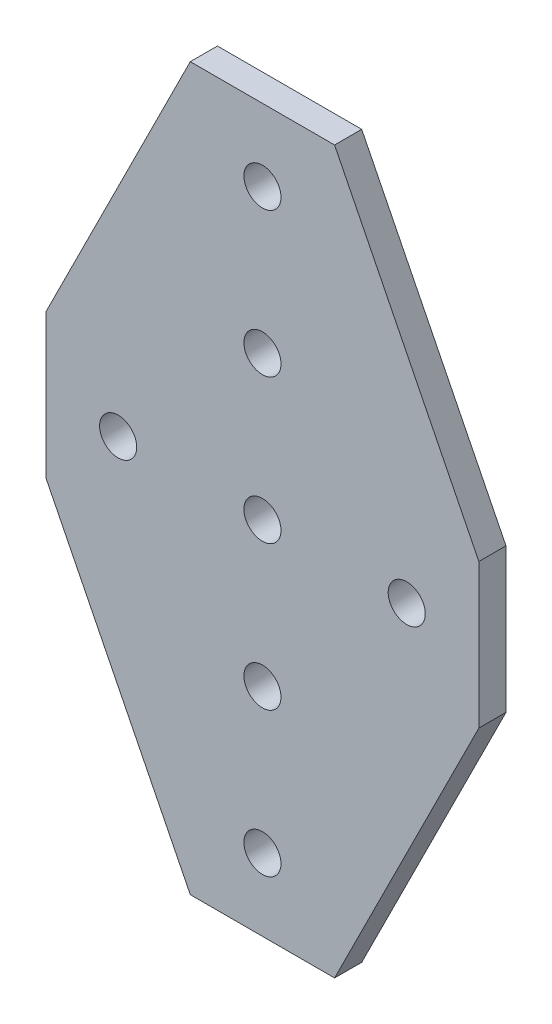
from build123d import *

# Parameters (mm, degrees)
BOSS_EXTRUDE1_DEPTH      = 2.3876
BOSS_EXTRUDE1_DEPTH_BACK = 2.3876
CUT_EXTRUDE1_DEPTH       = 75.206890078
CUT_EXTRUDE1_DEPTH_BACK  = 75.206890078
SKETCH4_R                = 3.2639
SKETCH5_R                = 3.2639
CUT_EXTRUDE2_DEPTH       = 75.206890078


with BuildPart() as part:
    # Sketch3 → Boss-Extrude1 (new, two sides: drawn at the far end of the back side and taken through both)
    with BuildSketch(Plane.XY.offset(-BOSS_EXTRUDE1_DEPTH_BACK)):
        Polygon((-12.7, 63.5), (12.7, 63.5), (38.1, 12.7), (38.1, -12.7), (12.7, -63.5), (-12.7, -63.5), (-38.1, -12.7), (-38.1, 12.7), align=None)
    extrude(amount=BOSS_EXTRUDE1_DEPTH + BOSS_EXTRUDE1_DEPTH_BACK)

    # Sketch4 → Cut-Extrude1 (cut, two sides: drawn at the far end of the back side and taken through both)
    with BuildSketch(Plane.XY.offset(2.3876).offset(-CUT_EXTRUDE1_DEPTH_BACK)):
        with Locations((0, 50.8)):
            Circle(SKETCH4_R)
        with Locations((0, 25.4)):
            Circle(SKETCH4_R)
        Circle(SKETCH4_R)
        with Locations((0, -25.4)):
            Circle(SKETCH4_R)
        with Locations((0, -50.8)):
            Circle(SKETCH4_R)
    extrude(amount=CUT_EXTRUDE1_DEPTH + CUT_EXTRUDE1_DEPTH_BACK, mode=Mode.SUBTRACT)

    # Sketch5 → Cut-Extrude2 (cut, through all)
    with BuildSketch(Plane.XY.offset(2.3876)):
        with Locations((25.4, 0)):
            Circle(SKETCH5_R)
        with Locations(Location((-25.4, 0, 0), (0, 0, 180))):
            Circle(SKETCH5_R)
    extrude(amount=-CUT_EXTRUDE2_DEPTH, mode=Mode.SUBTRACT)


solid = part.part
